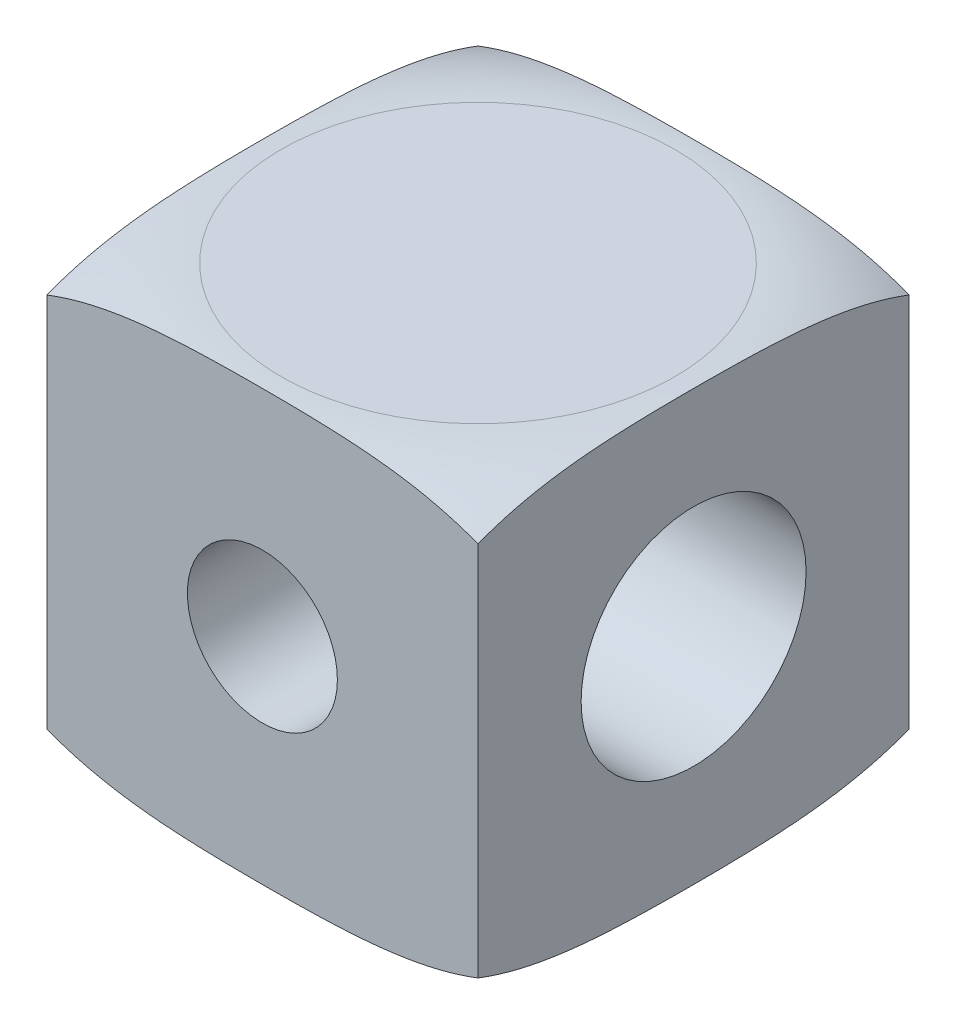
from build123d import *

# Parameters (mm, degrees)
SKETCH1_W           = 5.75
SKETCH1_H           = 5.75
BOSS_EXTRUDE1_DEPTH = 2.875
CUT_EXTRUDE1_REACH  = 9.042
SKETCH2_R           = 1
SKETCH3_R           = 1.5
CUT_EXTRUDE2_DEPTH  = 8.042283011


with BuildPart() as part:
    # Sketch1 → Boss-Extrude1 (new, symmetric)
    with BuildSketch(Plane(origin=(0, 0, 0), x_dir=(1, 0, 0), z_dir=(0, 1, 0))):
        Rectangle(SKETCH1_W, SKETCH1_H)
    extrude(amount=BOSS_EXTRUDE1_DEPTH, both=True)

    # Sketch2 → Cut-Extrude1 (cut, up to next)
    with BuildSketch(Plane.XY.offset(2.875), mode=Mode.PRIVATE) as cut_extrude1_sk1:
        Circle(SKETCH2_R)
    cut_extrude1_tool1 = extrude(cut_extrude1_sk1.sketch, amount=-CUT_EXTRUDE1_REACH, mode=Mode.PRIVATE) & part.part
    add(cut_extrude1_tool1.solids().sort_by_distance((0, 0, 2.875))[0], mode=Mode.SUBTRACT)

    # Sketch3 → Cut-Extrude2 (cut, through all)
    with BuildSketch(Plane.ZY.offset(2.875)):
        Circle(SKETCH3_R)
    extrude(amount=-CUT_EXTRUDE2_DEPTH, mode=Mode.SUBTRACT)

    # Sketch4 → Cut-Revolve1 (revolve, cut)
    with BuildSketch(Plane.XY, mode=Mode.PRIVATE) as cut_revolve1_sk:
        with BuildLine():
            Line((2.625, 2.875), (5.625, 2.875))
            Line((5.625, 2.875), (5.625, -0.125))
            ThreePointArc((5.625, -0.125), (4.746320344, 1.996320344), (2.625, 2.875))
        make_face()
    cut_revolve1 = revolve(cut_revolve1_sk.sketch.rotate(Axis((0, 0, 0), (0, 1, 0)), 90), axis=Axis((0, 0, 0), (0, 1, 0)), mode=Mode.SUBTRACT)

    # Mirror1: Cut-Revolve1 across plane
    add(cut_revolve1.mirror(Plane.ZX), mode=Mode.SUBTRACT)


solid = part.part
